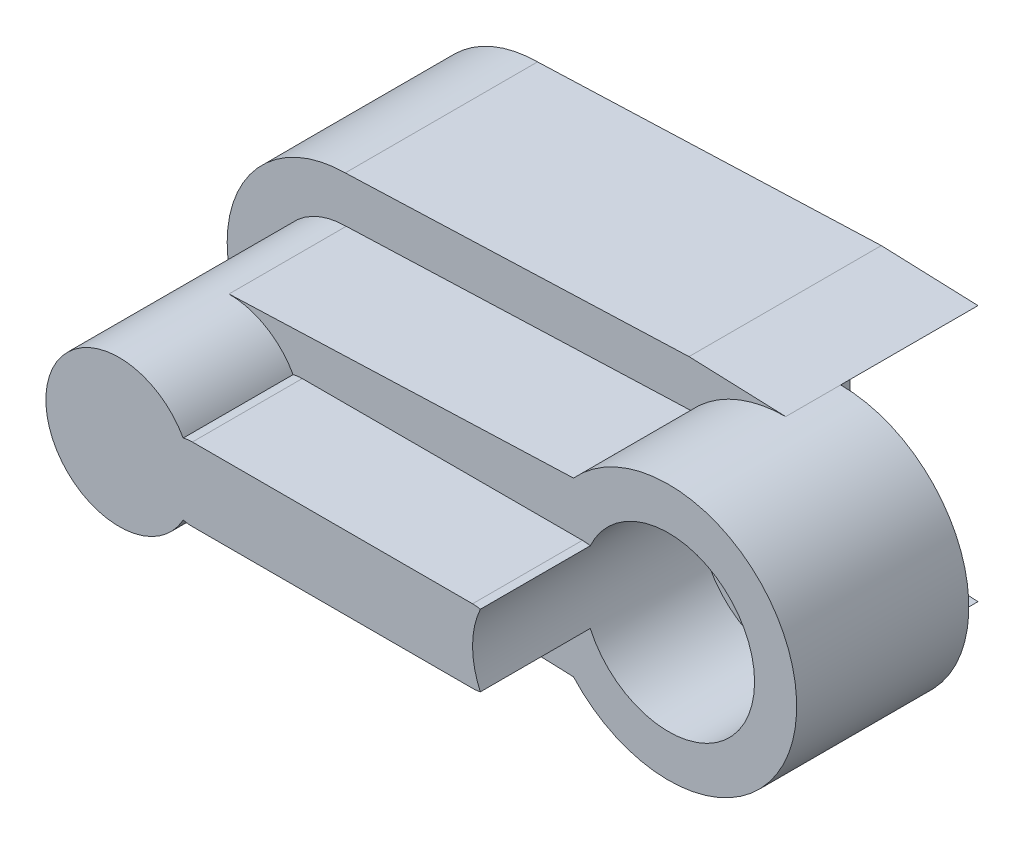
from build123d import *
from build123d.topology import SkipClean

# Parameters (mm, degrees)
SKETCH1_R           = 2.35
BOSS_EXTRUDE1_DEPTH = 6.7
BOSS_EXTRUDE2_DEPTH = 3
CUT_EXTRUDE1_DEPTH  = 2
SKETCH4_R           = 2.35
SKETCH4_R_2         = 1.45
BOSS_EXTRUDE3_DEPTH = 1.5
BOSS_EXTRUDE4_DEPTH = 1.5
BOSS_EXTRUDE5_START = 1.75
BOSS_EXTRUDE5_DEPTH = 1.75
BOSS_EXTRUDE6_START = 2
BOSS_EXTRUDE6_DEPTH = 2


with BuildPart() as part:
    # Sketch1 → Boss-Extrude1 (new body)
    with BuildSketch(Plane.XY):
        with BuildLine():
            Line((-1.533260445, 2.35), (-10.939517975, 2))
            ThreePointArc((-10.939517975, 2), (-12.939517975, 0), (-10.939517975, -2))
            Line((-10.939517975, -2), (-1.533260445, -2.35))
            ThreePointArc((-1.533260445, -2.35), (4.560482025, 0), (-1.533260445, 2.35))
        make_face()
        with Locations((1.060482025, 0)):
            Circle(SKETCH1_R, mode=Mode.SUBTRACT)
    extrude(amount=BOSS_EXTRUDE1_DEPTH)

    # Sketch2 → Boss-Extrude2 (add)
    with SkipClean():  # the faces are left unmerged after this step: merging them gives an invalid solid
        with BuildSketch(Plane.XY.offset(6.7)):
            with BuildLine():
                Line((-8.939517975, 1), (-1.289517975, 1))
                ThreePointArc((-1.289517975, 1), (-1.18252076, 0.99425932), (-1.076752018, 0.977103192))
                ThreePointArc((-1.076752018, 0.977103192), (-1.289517975, 0), (-1.076752018, -0.977103192))
                ThreePointArc((-1.076752018, -0.977103192), (-1.18252076, -0.99425932), (-1.289517975, -1))
                Line((-1.289517975, -1), (-8.939517975, -1))
                ThreePointArc((-8.939517975, -1), (-9.065522268, -0.992029696), (-9.189517975, -0.968245837))
                ThreePointArc((-9.189517975, -0.968245837), (-12.939517975, 0), (-9.189517975, 0.968245837))
                ThreePointArc((-9.189517975, 0.968245837), (-9.065522268, 0.992029696), (-8.939517975, 1))
            make_face()
        extrude(amount=BOSS_EXTRUDE2_DEPTH)

    # Sketch3 → Cut-Extrude1 (cut)
    with SkipClean():  # the faces are left unmerged after this step: merging them gives an invalid solid
        with BuildSketch(Plane(origin=(0, 0, 0), x_dir=(-1, 0, 0), z_dir=(0, 0, -1))):
            with BuildLine():
                Line((10.939517975, 2), (1.533260445, 2.35))
                ThreePointArc((1.533260445, 2.35), (-4.560482025, 0), (1.533260445, -2.35))
                Line((1.533260445, -2.35), (10.939517975, -2))
                ThreePointArc((10.939517975, -2), (12.939517975, 0), (10.939517975, 2))
            make_face()
        extrude(amount=-CUT_EXTRUDE1_DEPTH, mode=Mode.SUBTRACT)

    # Sketch4 → Boss-Extrude3 (add)
    with SkipClean():  # the faces are left unmerged after this step: merging them gives an invalid solid
        with BuildSketch(Plane(origin=(0, 0, 2), x_dir=(-1, 0, 0), z_dir=(0, 0, -1))):
            with Locations((-1.060482025, 0)):
                Circle(SKETCH4_R)
            with Locations((-1.060482025, 0)):
                Circle(SKETCH4_R_2, mode=Mode.SUBTRACT)
        extrude(amount=-BOSS_EXTRUDE3_DEPTH)

    # Sketch5 → Boss-Extrude4 (add)
    with SkipClean():  # the faces are left unmerged after this step: merging them gives an invalid solid
        with BuildSketch(Plane(origin=(0, 0, 2), x_dir=(-1, 0, 0), z_dir=(0, 0, -1))):
            with BuildLine():
                Line((-1.060482025, -3.5), (1.579739871, -3.599135566))
                Line((1.579739871, -3.599135566), (2.059938037, -3.581267742))
                Line((2.059938037, -3.581267742), (10.965572511, -3.249895562))
                ThreePointArc((10.965572511, -3.249895562), (14.189517975, 0), (10.965572511, 3.249895562))
                Line((10.965572511, 3.249895562), (2.059938037, 3.581267742))
                Line((2.059938037, 3.581267742), (1.579739871, 3.599135566))
                Line((1.579739871, 3.599135566), (-1.060482025, 3.5))
                ThreePointArc((-1.060482025, 3.5), (0.358144071, 3.199609351), (1.533260445, 2.35))
                Line((1.533260445, 2.35), (10.939517975, 2))
                ThreePointArc((10.939517975, 2), (12.939517975, 0), (10.939517975, -2))
                Line((10.939517975, -2), (1.533260445, -2.35))
                ThreePointArc((1.533260445, -2.35), (0.358144071, -3.199609351), (-1.060482025, -3.5))
            make_face()
        extrude(amount=-BOSS_EXTRUDE4_DEPTH)

    # Sketch7 → Boss-Extrude5 (add)
    with SkipClean():  # the faces are left unmerged after this step: merging them gives an invalid solid
        with BuildSketch(Plane(origin=(0, 0, 2), x_dir=(-1, 0, 0), z_dir=(0, 0, -1)).offset(BOSS_EXTRUDE5_START)):
            with BuildLine():
                ThreePointArc((10.965572511, -3.249895562), (12.19945489, -2.995840278), (13.244032441, -2.291661642))
                Line((13.244032441, -2.291661642), (0.86770197, -2.920976974))
                ThreePointArc((0.86770197, -2.920976974), (-0.05385881, -3.35212018), (-1.060482025, -3.5))
                Line((-1.060482025, -3.5), (1.579739871, -3.599135566))
                Line((1.579739871, -3.599135566), (10.965572511, -3.249895562))
            make_face()
            with BuildLine():
                Line((0.86770197, 2.920976974), (13.244032441, 2.291661642))
                ThreePointArc((13.244032441, 2.291661642), (12.19945489, 2.995840278), (10.965572511, 3.249895562))
                Line((10.965572511, 3.249895562), (1.579739871, 3.599135566))
                Line((1.579739871, 3.599135566), (-1.060482025, 3.5))
                ThreePointArc((-1.060482025, 3.5), (-0.05385881, 3.35212018), (0.86770197, 2.920976974))
            make_face()
        extrude(amount=-BOSS_EXTRUDE5_DEPTH)

    # Sketch8 → Boss-Extrude6 (add)
    with SkipClean():  # the faces are left unmerged after this step: merging them gives an invalid solid
        with BuildSketch(Plane(origin=(0, 0, 0.25), x_dir=(-1, 0, 0), z_dir=(0, 0, -1)).offset(BOSS_EXTRUDE6_START)):
            with BuildLine():
                Line((10.965572511, 3.249895562), (1.579739871, 3.599135566))
                Line((1.579739871, 3.599135566), (-1.060482025, 3.5))
                ThreePointArc((-1.060482025, 3.5), (2.439517975, 0), (-1.060482025, -3.5))
                Line((-1.060482025, -3.5), (1.579739871, -3.599135566))
                Line((1.579739871, -3.599135566), (10.965572511, -3.249895562))
                ThreePointArc((10.965572511, -3.249895562), (12.19945489, -2.995840278), (13.244032441, -2.291661642))
                Line((13.244032441, -2.291661642), (13.244032441, 2.291661642))
                ThreePointArc((13.244032441, 2.291661642), (12.19945489, 2.995840278), (10.965572511, 3.249895562))
            make_face()
        extrude(amount=-BOSS_EXTRUDE6_DEPTH)


solid = part.part
